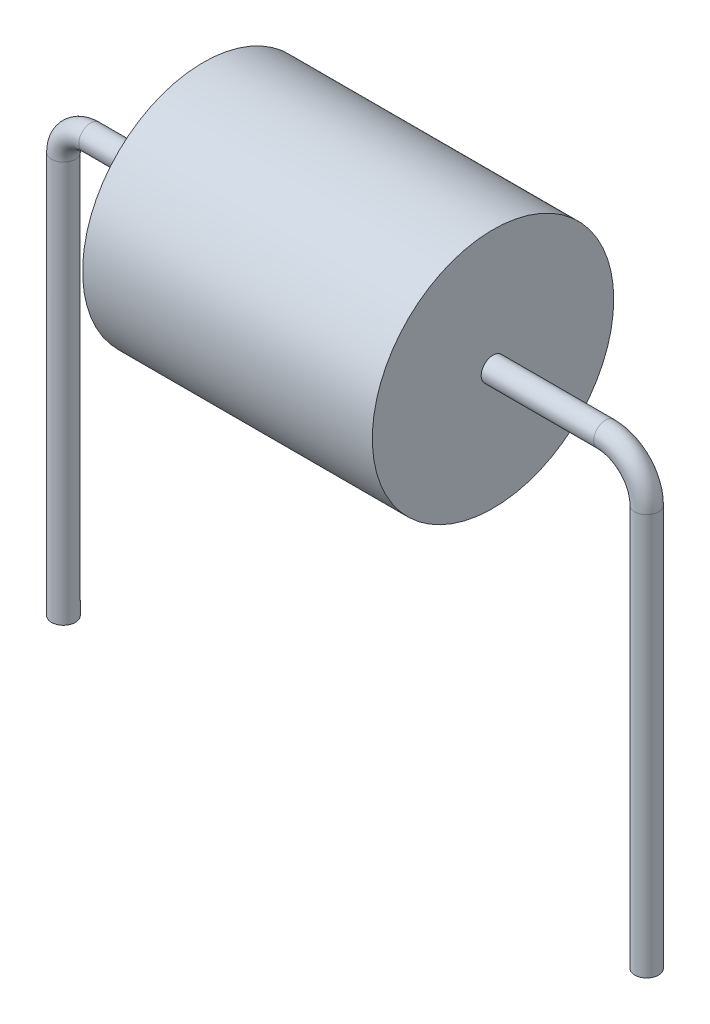
from build123d import *

# Parameters (mm, degrees)
IZIM1_R                     = 2.5
Y_KSEKLIK_EKSTR_ZYON1_DEPTH = 6
IZIM5_R                     = 0.246458924
IZIM7_R                     = 0.245


with BuildPart() as part:
    # Çizim1 → Yükseklik-Ekstrüzyon1 (new body)
    with BuildSketch(Plane(origin=(0, 0, 0), x_dir=(0, 0, -1), z_dir=(1, 0, 0))):
        Circle(IZIM1_R)
    extrude(amount=Y_KSEKLIK_EKSTR_ZYON1_DEPTH)

    # Süpür1: sweep along a path in Çizim4
    with BuildLine(Plane.XY) as s_p_r1_path:
        Line((0, 0), (-2.33257059, 0))
        ThreePointArc((-2.33257059, 0), (-2.732509931, -0.165660299), (-2.89817023, -0.56559964))
        Line((-2.89817023, -0.56559964), (-2.89817023, -8.872558098))
    # Çizim5 → Süpür1 (sweep)
    with BuildSketch(Plane(origin=(-2.89817023, -8.872558098, 0), x_dir=(-1, 0, 0), z_dir=(0, -1, 0))):
        with Locations((-0.000978554, 0)):
            Circle(IZIM5_R)
    sweep(path=s_p_r1_path.line)

    # Süpür2: sweep along a path in Çizim6
    with BuildLine(Plane.XY) as s_p_r2_path:
        Line((6, 0), (8.33, 0))
        ThreePointArc((8.33, 0), (8.931040764, -0.248959236), (9.18, -0.85))
        Line((9.18, -0.85), (9.18, -9.16))
    # Çizim7 → Süpür2 (sweep)
    with BuildSketch(Plane(origin=(9.18, -9.16, 0), x_dir=(-1, 0, 0), z_dir=(0, -1, 0))):
        with Locations((-0.002407495, 0)):
            Circle(IZIM7_R)
    sweep(path=s_p_r2_path.line)


solid = part.part
